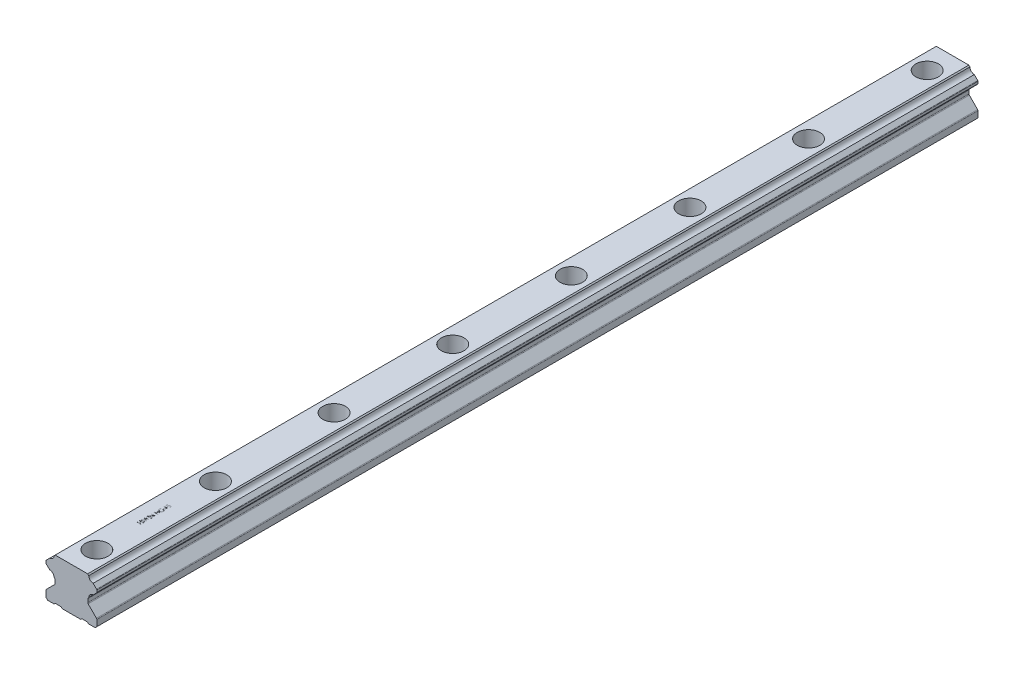
from build123d import *

# Parameters (mm, degrees)
EXTRUDE_1_DEPTH               = 780
HOLE_WIZARD_M12_1_D           = 14
HOLE_WIZARD_M12_1_CBORE_D     = 20
HOLE_WIZARD_M12_1_CBORE_DEPTH = 17
PATTERN_LINEAR_1_COUNT        = 8
PATTERN_LINEAR_1_PITCH        = 105
SKETCH_6_W                    = 3.5
SKETCH_6_H                    = 0.314102564
CUT_EXTRUDE_1_DEPTH           = 0.1


with BuildPart() as part:
    # 草图1 → 凸台-拉伸1 (new body)
    with BuildSketch(Plane.XY):
        with BuildLine():
            Line((-19.233341334, 33.16663182), (-22.265309617, 30.134663537))
            ThreePointArc((-22.265309617, 30.134663537), (-22.438727818, 29.875124858), (-22.499624192, 29.568978112))
            Line((-22.499624192, 29.568978112), (-22.499624192, 27.830992812))
            ThreePointArc((-22.499624192, 27.830992812), (-22.438727818, 27.524846066), (-22.265309617, 27.265307387))
            Line((-22.265309617, 27.265307387), (-19.234372624, 24.234370393))
            ThreePointArc((-19.234372624, 24.234370393), (-16.503490091, 23.063987063), (-15.333106761, 20.33310453))
            Line((-15.333106761, 20.33310453), (-14.851096055, 19.851093824))
            ThreePointArc((-14.851096055, 19.851093824), (-14.590968753, 19.461785806), (-14.499624192, 19.002565687))
            Line((-14.499624192, 19.002565687), (-14.499624192, 15.997382836))
            ThreePointArc((-14.499624192, 15.997382836), (-14.590968753, 15.538162718), (-14.851096055, 15.148854699))
            Line((-14.851096055, 15.148854699), (-22.14815233, 7.851798424))
            ThreePointArc((-22.14815233, 7.851798424), (-22.408279631, 7.462490406), (-22.499624192, 7.003270287))
            Line((-22.499624192, 7.003270287), (-22.499624192, 1.499999962))
            Line((-22.499624192, 1.499999962), (-20.999624192, -3.8e-08))
            Line((-20.999624192, -3.8e-08), (-15.249998508, -3.8e-08))
            Line((-15.249998508, -3.8e-08), (-14.249998867, 0.999999985))
            Line((-14.249998867, 0.999999985), (-9.249998977, 0.999999985))
            Line((-9.249998977, 0.999999985), (-8.249997823, 0))
            Line((-8.249997823, 0), (8.249997823, 0))
            Line((8.249997823, 0), (9.249998899, 1.000000167))
            Line((9.249998899, 1.000000167), (14.249997733, 0.999999955))
            Line((14.249997733, 0.999999955), (15.24999745, 0))
            Line((15.24999745, 0), (21.000375808, 0))
            Line((21.000375808, 0), (22.500375808, 1.5))
            Line((22.500375808, 1.5), (22.500375808, 7.003270325))
            ThreePointArc((22.500375808, 7.003270325), (22.409031247, 7.462490444), (22.148903945, 7.851798463))
            Line((22.148903945, 7.851798463), (14.85184767, 15.148854737))
            ThreePointArc((14.85184767, 15.148854737), (14.591720369, 15.538162756), (14.500375808, 15.997382875))
            Line((14.500375808, 15.997382875), (14.500375808, 19.002565725))
            ThreePointArc((14.500375808, 19.002565725), (14.591720369, 19.461785844), (14.85184767, 19.851093863))
            Line((14.85184767, 19.851093863), (15.333858376, 20.333104568))
            ThreePointArc((15.333858376, 20.333104568), (16.504241706, 23.063987102), (19.235124239, 24.234370432))
            Line((19.235124239, 24.234370432), (22.266061233, 27.265307425))
            ThreePointArc((22.266061233, 27.265307425), (22.439479434, 27.524846104), (22.500375808, 27.83099285))
            Line((22.500375808, 27.83099285), (22.500375808, 29.568978112))
            ThreePointArc((22.500375808, 29.568978112), (22.439479434, 29.875124858), (22.266061233, 30.134663537))
            Line((22.266061233, 30.134663537), (19.23409295, 33.16663182))
            ThreePointArc((19.23409295, 33.16663182), (16.504241706, 34.33698986), (15.333883666, 37.066841103))
            Line((15.333883666, 37.066841103), (14.400724808, 37.999999962))
            Line((14.400724808, 37.999999962), (-14.399973192, 37.999999962))
            Line((-14.399973192, 37.999999962), (-15.33313205, 37.066841103))
            ThreePointArc((-15.33313205, 37.066841103), (-16.503490091, 34.33698986), (-19.233341334, 33.16663182))
        make_face()
    extrude(amount=-EXTRUDE_1_DEPTH)

    # M12 六角凹头螺钉的柱形沉头孔1 (through all)
    with Locations(Plane(origin=(-6.045952909, 37.999999962, -69.000233732), x_dir=(-1, 0, 0), z_dir=(0, 1, 0))):
        with Locations((-6.045952909, 46.500233732)):
            hole_wizard_m12_1 = CounterBoreHole(HOLE_WIZARD_M12_1_D / 2, HOLE_WIZARD_M12_1_CBORE_D / 2, HOLE_WIZARD_M12_1_CBORE_DEPTH)

    # 阵列(线性)1: M12 六角凹头螺钉的柱形沉头孔1 ×8
    with Locations(*[(0, 0, -i * PATTERN_LINEAR_1_PITCH) for i in range(1, PATTERN_LINEAR_1_COUNT)]):
        add(hole_wizard_m12_1, mode=Mode.SUBTRACT)

    # 草图6 → 切除-拉伸1 (cut)
    # profile 1 of 9: a face of its own
    with BuildSketch(Plane(origin=(0, 37.999999962, 0), x_dir=(1, 0, 0), z_dir=(0, 1, 0))):
        Polygon((-3.5, 61.403846154), (-3.5, 61.717948718), (-2.064102564, 61.717948718), (-2.064102564, 63.512820513), (-3.5, 63.512820513), (-3.5, 63.826923077), (0, 63.826923077), (0, 63.512820513), (-1.705128205, 63.512820513), (-1.705128205, 61.717948718), (0, 61.717948718), (0, 61.403846154), align=None)
    # profile 2 of 9: a face of its own
    with BuildSketch(Plane(origin=(0, 37.999999962, 0), x_dir=(1, 0, 0), z_dir=(0, 1, 0))):
        with Locations((-1.75, 64.881410256)):
            Rectangle(SKETCH_6_W, SKETCH_6_H)
    # profile 3 of 9: a face of its own
    with BuildSketch(Plane(origin=(0, 37.999999962, 0), x_dir=(1, 0, 0), z_dir=(0, 1, 0))):
        Polygon((-3.5, 65.576923077), (-3.5, 65.901542468), (-0.933193109, 66.586538462), (-3.5, 67.605268429), (-3.5, 67.650841346), (-0.950721154, 68.650641026), (-3.5, 69.339142628), (-3.5, 69.66025641), (0, 68.716546474), (0, 68.671674679), (-2.676883013, 67.618589744), (0, 66.552884615), (0, 66.508012821), align=None)
    # profile 4 of 9: a face of its own
    with BuildSketch(Plane(origin=(0, 37.999999962, 0), x_dir=(1, 0, 0), z_dir=(0, 1, 0))):
        with Locations((-1.75, 70.625)):
            Rectangle(SKETCH_6_W, SKETCH_6_H)
    # profile 5 of 9: a face of its own
    with BuildSketch(Plane(origin=(0, 37.999999962, 0), x_dir=(1, 0, 0), z_dir=(0, 1, 0))):
        Polygon((0, 71.544871795), (-3.5, 71.544871795), (-3.5, 71.610777244), (-0.745292468, 73.923076923), (-3.5, 73.923076923), (-3.5, 74.237179487), (0, 74.237179487), (0, 74.165665064), (-2.748397436, 71.858974359), (0, 71.858974359), align=None)
    # profile 6 of 9: a face of its own
    with BuildSketch(Plane(origin=(0, 37.999999962, 0), x_dir=(1, 0, 0), z_dir=(0, 1, 0))):
        Polygon((-3.5, 76.480769231), (-3.5, 76.794871795), (-2.064102564, 76.794871795), (-2.064102564, 78.58974359), (-3.5, 78.58974359), (-3.5, 78.903846154), (0, 78.903846154), (0, 78.58974359), (-1.705128205, 78.58974359), (-1.705128205, 76.794871795), (0, 76.794871795), (0, 76.480769231), align=None)
    # profile 7 of 9: a face of its own
    with BuildSketch(Plane(origin=(0, 37.999999962, 0), x_dir=(1, 0, 0), z_dir=(0, 1, 0))):
        with BuildLine():
            Line((-2.902644231, 83.076923077), (-2.647435897, 82.807692308))
            add(Edge.make_bspline(
                [(-2.647435897, 82.807692308), (-2.69328212, 82.758983227), (-2.783881335, 82.662726562), (-2.901244074, 82.50552662), (-3.002777003, 82.342170767), (-3.084772592, 82.172394867), (-3.149094254, 82.000650867), (-3.195850217, 81.829891913), (-3.225460377, 81.661223615), (-3.229016796, 81.549059313), (-3.230769231, 81.493790064)],
                knots=[0, 0, 0, 0, 1.089067066, 2.152164705, 3.18986567, 4.218445106, 5.218487318, 6.173592265, 7.100032889, 8, 8, 8, 8], degree=3))
            add(Edge.make_bspline(
                [(-3.230769231, 81.493790064), (-3.230355625, 81.459875364), (-3.229529486, 81.392133924), (-3.218985271, 81.29151198), (-3.203820407, 81.191945342), (-3.181878529, 81.093621968), (-3.15406947, 80.99635068), (-3.119284004, 80.900469793), (-3.078728771, 80.805800421), (-3.031866252, 80.713234402), (-2.980386575, 80.623493669), (-2.923337414, 80.538737672), (-2.862550889, 80.458421211), (-2.796491613, 80.384072004), (-2.725807311, 80.31519549), (-2.651770944, 80.250524789), (-2.572926872, 80.191265211), (-2.489599321, 80.138479571), (-2.403726867, 80.090811977), (-2.316037795, 80.049619777), (-2.227346143, 80.013809823), (-2.136984078, 79.986535862), (-2.045883197, 79.963434988), (-1.953566086, 79.947353752), (-1.859791669, 79.938257435), (-1.796993971, 79.936686944), (-1.765424679, 79.935897436)],
                knots=[0, 0, 0, 0, 1.028150113, 2.053633673, 3.06513288, 4.081487945, 5.106702018, 6.131327874, 7.172780699, 8.228344599, 9.276313556, 10.308389736, 11.324843658, 12.329040066, 13.321460474, 14.316307835, 15.308626991, 16.309440696, 17.305625405, 18.28535951, 19.246194545, 20.203493668, 21.145557131, 22.095268976, 23.042464743, 24, 24, 24, 24], degree=3))
            add(Edge.make_bspline(
                [(-1.765424679, 79.935897436), (-1.733154018, 79.936653631), (-1.668700816, 79.938163957), (-1.572504414, 79.947817154), (-1.477747832, 79.965772364), (-1.384282029, 79.989584114), (-1.291920993, 80.019856789), (-1.20076111, 80.057049303), (-1.110811241, 80.101355435), (-1.022964324, 80.152526704), (-0.937464192, 80.209036172), (-0.856251713, 80.271187356), (-0.780271995, 80.339084893), (-0.708415252, 80.411483836), (-0.641134974, 80.489043832), (-0.579242122, 80.572517364), (-0.521779643, 80.660735956), (-0.469378807, 80.753738745), (-0.42257144, 80.850542725), (-0.38094723, 80.949799156), (-0.346667976, 81.051827058), (-0.31872985, 81.156089724), (-0.295829559, 81.262463002), (-0.281097077, 81.371486803), (-0.270406246, 81.482359512), (-0.269624576, 81.557098144), (-0.269230769, 81.594751603)],
                knots=[0, 0, 0, 0, 0.935915162, 1.869274651, 2.799799983, 3.730201895, 4.664668062, 5.616159355, 6.583070886, 7.570012957, 8.562524459, 9.553461134, 10.53281078, 11.515274572, 12.509912756, 13.507571325, 14.526460018, 15.561318395, 16.601025881, 17.643204557, 18.680545676, 19.719612342, 20.772381578, 21.833430283, 22.908478249, 24, 24, 24, 24], degree=3))
            add(Edge.make_bspline(
                [(-0.269230769, 81.594751603), (-0.270178952, 81.640130135), (-0.272040863, 81.729238255), (-0.286546735, 81.860222075), (-0.309173205, 81.986034693), (-0.342412256, 82.106266531), (-0.384484705, 82.221353926), (-0.436513285, 82.330872414), (-0.497950569, 82.435124408), (-0.567552463, 82.533658668), (-0.645100929, 82.624132689), (-0.728035637, 82.706474768), (-0.817431068, 82.77785339), (-0.911954918, 82.840400707), (-1.012511326, 82.892097951), (-1.118540888, 82.934543829), (-1.230109213, 82.967076285), (-1.307200733, 82.980431374), (-1.346153846, 82.987179487)],
                knots=[0, 0, 0, 0, 1.130199668, 2.219330667, 3.279027493, 4.311506524, 5.322739849, 6.327972234, 7.327472899, 8.33386792, 9.329086447, 10.29244429, 11.240784345, 12.174119183, 13.111530729, 14.052100829, 15.015757696, 16, 16, 16, 16], degree=3))
            Line((-1.346153846, 82.987179487), (-1.346153846, 81.820512821))
            Line((-1.346153846, 81.820512821), (-1.705128205, 81.820512821))
            Line((-1.705128205, 81.820512821), (-1.705128205, 83.301282051))
            add(Edge.make_bspline(
                [(-1.705128205, 83.301282051), (-1.638220716, 83.299576203), (-1.507270675, 83.296237549), (-1.316300404, 83.272818634), (-1.13592871, 83.235002122), (-0.965965639, 83.18334181), (-0.806652046, 83.116466529), (-0.65782618, 83.035094001), (-0.520449499, 82.93792188), (-0.393400495, 82.828411438), (-0.280071283, 82.705511481), (-0.180465345, 82.572542861), (-0.09656273, 82.429285892), (-0.028302067, 82.275876085), (0.024971927, 82.112815651), (0.062743504, 81.939727272), (0.085373467, 81.756845671), (0.088264847, 81.631508994), (0.08974359, 81.567407853)],
                knots=[0, 0, 0, 0, 1.140356446, 2.231883559, 3.274166699, 4.278491846, 5.25512956, 6.21435461, 7.1637429, 8.11826594, 9.068280886, 10.0076534, 10.945064095, 11.891975133, 12.864533718, 13.863980011, 14.907571808, 16, 16, 16, 16], degree=3))
            add(Edge.make_bspline(
                [(0.08974359, 81.567407853), (0.089174469, 81.527897717), (0.088051978, 81.449970996), (0.080074631, 81.334880068), (0.067794054, 81.222962448), (0.049248931, 81.114234439), (0.026534277, 81.008296097), (-0.002552442, 80.905676512), (-0.036221141, 80.80598477), (-0.074516815, 80.709066784), (-0.118888472, 80.615802237), (-0.168198111, 80.52577572), (-0.222191472, 80.438489595), (-0.281802318, 80.35453843), (-0.346584778, 80.273484808), (-0.416668697, 80.195851364), (-0.491839816, 80.121203486), (-0.545218826, 80.074443023), (-0.572115385, 80.05088141)],
                knots=[0, 0, 0, 0, 1.107784379, 2.184907829, 3.233506516, 4.263428166, 5.276301166, 6.270063455, 7.25232949, 8.225834625, 9.190232166, 10.146266622, 11.1027726, 12.066435141, 13.031522626, 14.010570082, 14.99756817, 16, 16, 16, 16], degree=3))
            add(Edge.make_bspline(
                [(-0.572115385, 80.05088141), (-0.614786038, 80.016695478), (-0.699419055, 79.948891066), (-0.835018999, 79.861612909), (-0.975420859, 79.787211506), (-1.121015488, 79.726843684), (-1.271666701, 79.679705598), (-1.427181992, 79.645899345), (-1.587761622, 79.626092056), (-1.696426887, 79.623238518), (-1.751402244, 79.621794872)],
                knots=[0, 0, 0, 0, 1.023165419, 2.029347347, 3.013907458, 3.994755782, 4.975994455, 5.96558838, 6.970761222, 8, 8, 8, 8], degree=3))
            add(Edge.make_bspline(
                [(-1.751402244, 79.621794872), (-1.792568496, 79.62232711), (-1.874377804, 79.623384821), (-1.99583511, 79.636210339), (-2.115135808, 79.654611751), (-2.232182344, 79.681658827), (-2.347053012, 79.715755013), (-2.45980069, 79.758308794), (-2.570493643, 79.807852572), (-2.67836343, 79.865442289), (-2.782003044, 79.929511026), (-2.880905313, 79.999118682), (-2.973467332, 80.074802367), (-3.059903521, 80.156782462), (-3.141494975, 80.243406392), (-3.216537375, 80.336492693), (-3.286205011, 80.434631029), (-3.349159221, 80.538582169), (-3.405727075, 80.6467058), (-3.455315154, 80.758766886), (-3.496298775, 80.874724704), (-3.531072472, 80.993712261), (-3.556787635, 81.11662974), (-3.575436374, 81.242585283), (-3.588196976, 81.372235393), (-3.589223231, 81.459871423), (-3.58974359, 81.504306891)],
                knots=[0, 0, 0, 0, 1.00895651, 2.005089799, 2.991467152, 3.967318338, 4.948153826, 5.927364234, 6.919980553, 7.91976625, 8.923240147, 9.905815003, 10.88314567, 11.851989312, 12.825009789, 13.798721852, 14.781296708, 15.773896486, 16.776076962, 17.771600213, 18.775744723, 19.78957137, 20.808953803, 21.851964491, 22.910847925, 24, 24, 24, 24], degree=3))
            add(Edge.make_bspline(
                [(-3.58974359, 81.504306891), (-3.589164098, 81.540545135), (-3.588015034, 81.612401313), (-3.580050386, 81.719327046), (-3.567426505, 81.82460006), (-3.550199718, 81.92837645), (-3.526736028, 82.030302816), (-3.498657743, 82.130669522), (-3.46596592, 82.229622058), (-3.426977074, 82.326850307), (-3.382723449, 82.423008023), (-3.332910027, 82.518629864), (-3.276685022, 82.61338911), (-3.213881487, 82.707450091), (-3.145578069, 82.801405949), (-3.069821245, 82.893770591), (-2.989598489, 82.986773536), (-2.931916305, 83.04657535), (-2.902644231, 83.076923077)],
                knots=[0, 0, 0, 0, 0.985871117, 1.954866573, 2.915460327, 3.869826059, 4.81536089, 5.759505086, 6.70452669, 7.649098992, 8.607881297, 9.583363685, 10.581137262, 11.603961102, 12.659522466, 13.73993555, 14.853081303, 16, 16, 16, 16], degree=3))
        make_face()
    # profile 8 of 9: a face of its own
    with BuildSketch(Plane(origin=(0, 37.999999962, 0), x_dir=(1, 0, 0), z_dir=(0, 1, 0))):
        Polygon((-3.58974359, 85.615685096), (-3.58974359, 85.679487179), (-1.166666667, 85.679487179), (-1.166666667, 86.083333333), (-0.807692308, 86.083333333), (-0.807692308, 85.679487179), (0, 85.679487179), (0, 85.365384615), (-0.807692308, 85.365384615), (-0.807692308, 83.705128205), align=None)
        Polygon((-1.166666667, 85.365384615), (-2.686698718, 85.365384615), (-1.166666667, 84.322115385), align=None, mode=Mode.SUBTRACT)
    # profile 9 of 9: a face of its own
    with BuildSketch(Plane(origin=(0, 37.999999962, 0), x_dir=(1, 0, 0), z_dir=(0, 1, 0))):
        with BuildLine():
            Line((-3.5, 88.596153846), (-3.141025641, 88.596153846))
            Line((-3.141025641, 88.596153846), (-3.141025641, 87.405649038))
            Line((-3.141025641, 87.405649038), (-2.220452724, 87.217047276))
            add(Edge.make_bspline(
                [(-2.220452724, 87.217047276), (-2.230682996, 87.25410315), (-2.25050253, 87.325893046), (-2.2725083, 87.431852907), (-2.285773744, 87.53244511), (-2.287585055, 87.597720481), (-2.288461538, 87.629306891)],
                knots=[0, 0, 0, 0, 1.100273476, 2.13160584, 3.095893838, 4, 4, 4, 4], degree=3))
            add(Edge.make_bspline(
                [(-2.288461538, 87.629306891), (-2.28764354, 87.668397805), (-2.28603515, 87.745260309), (-2.269673986, 87.857544614), (-2.245976174, 87.96527195), (-2.209465207, 88.066851732), (-2.164878805, 88.163891055), (-2.108721258, 88.254723386), (-2.04315746, 88.34062356), (-1.968525078, 88.420997879), (-1.885534459, 88.493570878), (-1.795933934, 88.556634421), (-1.701678739, 88.611677196), (-1.600559725, 88.654605621), (-1.494484031, 88.689639403), (-1.382227183, 88.712740767), (-1.264785773, 88.728171477), (-1.18448027, 88.729891917), (-1.143529647, 88.730769231)],
                knots=[0, 0, 0, 0, 1.052805225, 2.070078116, 3.052532748, 4.020689046, 4.973125432, 5.925915817, 6.89216474, 7.881560752, 8.877013184, 9.857446635, 10.830895175, 11.812622661, 12.812548702, 13.836681939, 14.896847428, 16, 16, 16, 16], degree=3))
            add(Edge.make_bspline(
                [(-1.143529647, 88.730769231), (-1.115007605, 88.730103556), (-1.058348972, 88.728781204), (-0.974202158, 88.7220714), (-0.891849045, 88.709103007), (-0.811440613, 88.69190289), (-0.732901554, 88.668941583), (-0.65579213, 88.642084161), (-0.580956685, 88.608702163), (-0.508064701, 88.571694489), (-0.437950402, 88.530715464), (-0.372294905, 88.484635462), (-0.309599937, 88.436755685), (-0.251727444, 88.384438189), (-0.198452948, 88.328277796), (-0.149513072, 88.268586987), (-0.104029493, 88.205907167), (-0.063861909, 88.139251137), (-0.026898788, 88.070108867), (0.003424705, 87.997480593), (0.030535245, 87.923019908), (0.05214477, 87.845655028), (0.069077325, 87.765561217), (0.080577925, 87.682606441), (0.088954363, 87.597225771), (0.08947872, 87.539350758), (0.08974359, 87.510116186)],
                knots=[0, 0, 0, 0, 1.056393913, 2.098511576, 3.122979385, 4.141471433, 5.141222888, 6.151259816, 7.162667642, 8.172852865, 9.177685681, 10.166741883, 11.141342384, 12.097242845, 13.052202613, 14.005160326, 14.953864445, 15.917140761, 16.884916217, 17.854238259, 18.828761908, 19.81781811, 20.826036654, 21.857789401, 22.917898972, 24, 24, 24, 24], degree=3))
            add(Edge.make_bspline(
                [(0.08974359, 87.510116186), (0.089050894, 87.475242894), (0.087688097, 87.406633813), (0.073496095, 87.30610057), (0.053035464, 87.209432256), (0.022721931, 87.117043177), (-0.016971483, 87.029318648), (-0.064133263, 86.945002475), (-0.12027864, 86.865139718), (-0.184894072, 86.790276377), (-0.255892818, 86.721460371), (-0.332202561, 86.65905751), (-0.413920487, 86.604193873), (-0.500780871, 86.556670445), (-0.592629648, 86.516184815), (-0.689749822, 86.484366409), (-0.791650601, 86.45868899), (-0.861804004, 86.447825441), (-0.897435897, 86.442307692)],
                knots=[0, 0, 0, 0, 1.046872515, 2.059598001, 3.044168548, 4.012104806, 4.973680974, 5.932408326, 6.910122221, 7.900780896, 8.89867654, 9.876692837, 10.858029398, 11.85084981, 12.847361615, 13.868568023, 14.917415949, 16, 16, 16, 16], degree=3))
            Line((-0.897435897, 86.442307692), (-0.897435897, 86.756410256))
            add(Edge.make_bspline(
                [(-0.897435897, 86.756410256), (-0.86405597, 86.764133979), (-0.799897896, 86.778979402), (-0.709812799, 86.811649494), (-0.62950762, 86.851206459), (-0.558491359, 86.899340396), (-0.495464081, 86.955133792), (-0.43989307, 87.019990731), (-0.389697273, 87.092289811), (-0.347784769, 87.17267219), (-0.312479137, 87.257640252), (-0.287283878, 87.346063351), (-0.272032646, 87.436668904), (-0.270168243, 87.497671524), (-0.269230769, 87.528345353)],
                knots=[0, 0, 0, 0, 1.13623081, 2.183898708, 3.172478118, 4.09966615, 5.022692284, 5.957376522, 6.927682873, 7.937366477, 8.960015386, 9.976409503, 10.982481913, 12, 12, 12, 12], degree=3))
            add(Edge.make_bspline(
                [(-0.269230769, 87.528345353), (-0.270058415, 87.558301256), (-0.271688055, 87.617284674), (-0.284028564, 87.704132513), (-0.303533592, 87.787735767), (-0.33085902, 87.868242843), (-0.367008958, 87.945258145), (-0.411417074, 88.018672781), (-0.462975425, 88.089532607), (-0.521904738, 88.1559727), (-0.586881759, 88.216808942), (-0.656357238, 88.270565902), (-0.730474586, 88.315342595), (-0.807947606, 88.353076763), (-0.889626199, 88.381730046), (-0.975127364, 88.402171031), (-1.064662347, 88.414174089), (-1.125731657, 88.415825269), (-1.156850962, 88.416666667)],
                knots=[0, 0, 0, 0, 1.027268864, 2.022700798, 3.002744649, 3.968653148, 4.933396556, 5.915045722, 6.907600446, 7.935526002, 8.956456544, 9.95700807, 10.942805781, 11.92166854, 12.907987664, 13.905483474, 14.932689774, 16, 16, 16, 16], degree=3))
            add(Edge.make_bspline(
                [(-1.156850962, 88.416666667), (-1.184930032, 88.416028195), (-1.239659043, 88.414783746), (-1.320009695, 88.404010642), (-1.396158478, 88.386014341), (-1.468436727, 88.360391264), (-1.536613353, 88.328412845), (-1.600538112, 88.288262971), (-1.660812066, 88.241651258), (-1.715884112, 88.187233139), (-1.766793088, 88.12803749), (-1.810034281, 88.062543866), (-1.846807397, 87.992500701), (-1.876936465, 87.917778197), (-1.900936575, 87.838284311), (-1.917523378, 87.753976228), (-1.92744867, 87.664834733), (-1.928795087, 87.603859089), (-1.929487179, 87.572516026)],
                knots=[0, 0, 0, 0, 1.045723156, 2.038222538, 3.013889863, 3.95567481, 4.890389958, 5.81331128, 6.76251276, 7.723027653, 8.692928204, 9.666105983, 10.639751036, 11.635719707, 12.66315958, 13.728667616, 14.832476222, 16, 16, 16, 16], degree=3))
            add(Edge.make_bspline(
                [(-1.929487179, 87.572516026), (-1.928906588, 87.545387097), (-1.927707815, 87.489372742), (-1.918881318, 87.403449915), (-1.904642024, 87.313158192), (-1.885055776, 87.218843696), (-1.859424699, 87.120223188), (-1.828710199, 87.017504787), (-1.7919882, 86.910472521), (-1.764255986, 86.838354796), (-1.75, 86.801282051)],
                knots=[0, 0, 0, 0, 0.817624296, 1.688186739, 2.600797293, 3.572016777, 4.590301741, 5.671205678, 6.80286297, 8, 8, 8, 8], degree=3))
            Line((-1.75, 86.801282051), (-3.5, 87.16025641))
            Line((-3.5, 87.16025641), (-3.5, 88.596153846))
        make_face()
    extrude(amount=-CUT_EXTRUDE_1_DEPTH, mode=Mode.SUBTRACT)


solid = part.part
